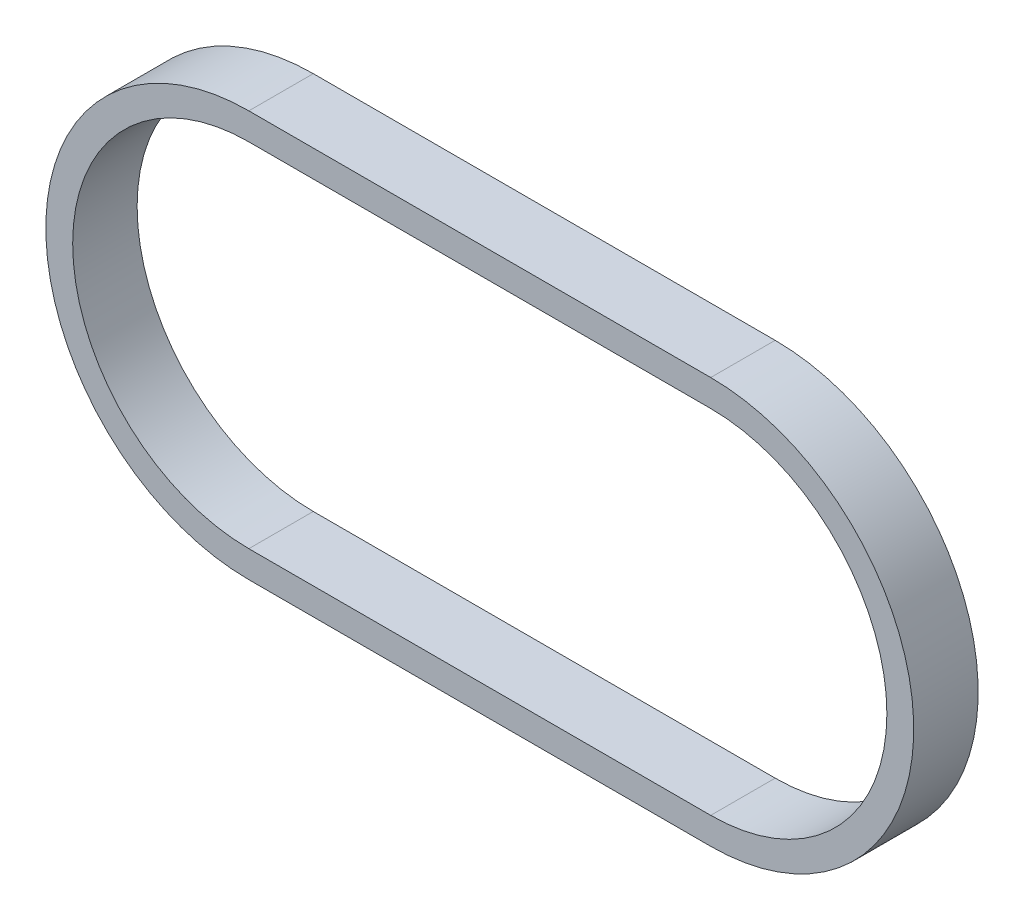
from build123d import *

# Parameters (mm, degrees)
BOSS_EXTRU_2_DEPTH = 6


with BuildPart() as part:
    # Esquisse4 → Boss.-Extru.2 (new body)
    with BuildSketch(Plane.XY):
        with BuildLine():
            Line((-21.5, -18.9), (21.5, -18.9))
            ThreePointArc((21.5, -18.9), (40.4, 0), (21.5, 18.9))
            Line((21.5, 18.9), (-21.5, 18.9))
            ThreePointArc((-21.5, 18.9), (-40.4, 0), (-21.5, -18.9))
        make_face()
        with BuildLine():
            Line((21.5, -16.4), (-21.5, -16.4))
            ThreePointArc((-21.5, -16.4), (-37.9, 0), (-21.5, 16.4))
            Line((-21.5, 16.4), (21.5, 16.4))
            ThreePointArc((21.5, 16.4), (37.9, 0), (21.5, -16.4))
        make_face(mode=Mode.SUBTRACT)
    extrude(amount=BOSS_EXTRU_2_DEPTH)


solid = part.part
